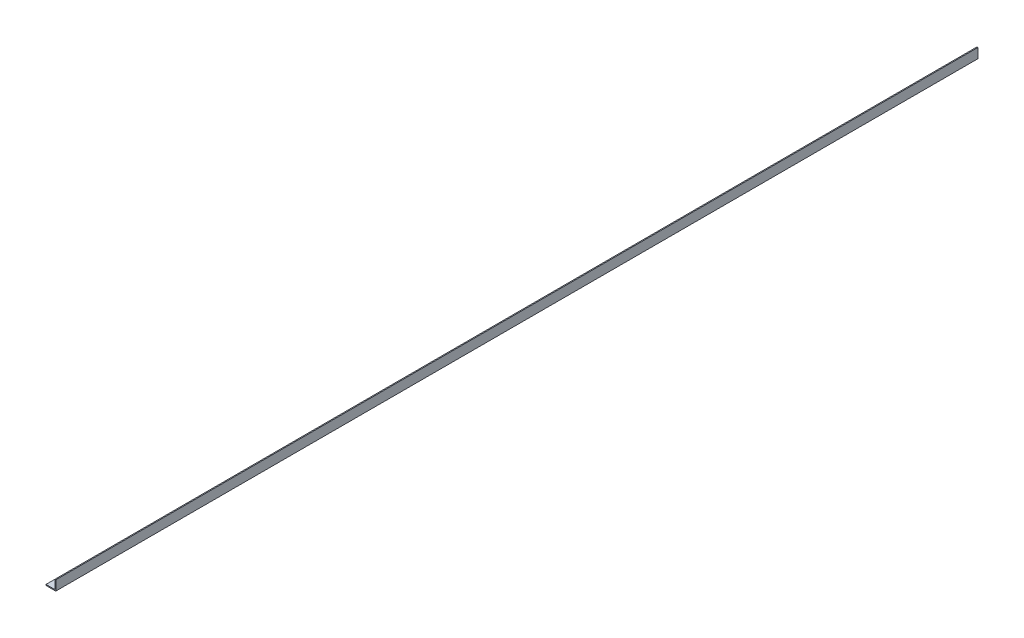
from build123d import *

# Parameters (mm, degrees)
SALIENTE_EXTRUIR1_DEPTH = 6000


with BuildPart() as part:
    # Croquis1 → Saliente-Extruir1 (new body)
    with BuildSketch(Plane.XY):
        Polygon((0, 0), (-63.5, 0), (-63.5, 6.35), (-6.35, 6.35), (-6.35, 63.5), (0, 63.5), align=None)
    extrude(amount=SALIENTE_EXTRUIR1_DEPTH)


solid = part.part
